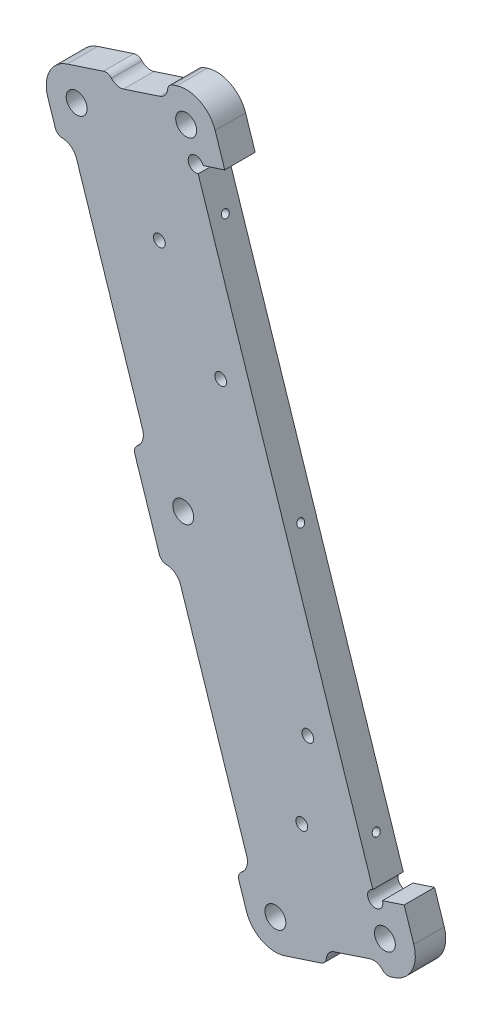
from build123d import *

# Parameters (mm, degrees)
BOSS_EXTRUDE1_DEPTH                               = 12.7
FILLET1_R                                         = 12.7
F_1_4_0_25_DIAMETER_HOLE1_D                       = 6.35
HOLE1_D                                           = 3.175
HOLE1_DEPTH                                       = 38.1
HOLE1_CSINK_D                                     = 10.16
HOLE1_CSINK_ANGLE                                 = 82
HOLE1_TIP                                         = 0.9538662327062519
F_5_16_CLEARANCE_HOLE1_D                          = 8.72998
CUT_EXTRUDE1_DEPTH                                = 998.2767957894854
FILLET2_R                                         = 3.175
CSK_FOR_8_FLAT_HEAD_MACHINE_SCREW_100_D           = 4.9149
CSK_FOR_8_FLAT_HEAD_MACHINE_SCREW_100_DEPTH       = 22.225
CSK_FOR_8_FLAT_HEAD_MACHINE_SCREW_100_CSINK_D     = 16.0004506
CSK_FOR_8_FLAT_HEAD_MACHINE_SCREW_100_CSINK_ANGLE = 100
CSK_FOR_8_FLAT_HEAD_MACHINE_SCREW_100_TIP         = 1.476584928229278


with BuildPart() as part:
    # Sketch1 → Boss-Extrude1 (new body)
    with BuildSketch(Plane.XY):
        Polygon((-504.586893891522, 825.1654748045078), (-413.82187552728277, 548.4721148571872), (-471.5394528912339, 529.5387477161187), (-562.3044712554732, 806.2321076634394), align=None)
        Polygon((-421.80123191535296, 572.7968488683923), (-413.82187552728277, 548.4721148571872), (-401.754552912923, 552.4306151945574), (-409.7339093009929, 576.7553492057625), align=None)
        Polygon((-504.586893891522, 825.1654748045078), (-492.51957127716224, 829.123975141878), (-484.5402148890918, 804.7992411306724), (-496.6075375034517, 800.8407407933022), align=None)
    extrude(amount=BOSS_EXTRUDE1_DEPTH)

    # Fillet1
    fillet1_edges = [part.edges().sort_by_distance(p)[0] for p in [
        (-401.754552912923, 552.4306151945574, 6.35),
        (-471.5394528912339, 529.5387477161187, 6.35),
        (-562.3044712554732, 806.2321076634394, 6.35),
        (-492.51957127716224, 829.123975141878, 6.35),
    ]]
    fillet(fillet1_edges, radius=FILLET1_R)

    # 1/4 (0.25) Diameter Hole1 (through all)
    with Locations(Plane(origin=(0, 0, 0), x_dir=(-1, 0, 0), z_dir=(0, 0, -1))):
        with Locations((496.607537503, 800.840740793), (421.801231915, 572.796848868)):
            Hole(F_1_4_0_25_DIAMETER_HOLE1_D / 2)

    # Hole1
    with Locations(Plane(origin=(-72.82198225638447, -450.30656055117834, -91.0749999969487), x_dir=(-4.8e-16, -1.6e-16, -1), z_dir=(0.9501828830204595, 0.3116929399504066, 0))):
        with Locations((-97.424999997, 1099.959715498), (-97.424999997, 1301.859715498), (-97.424999997, 1200.909715498)):
            CounterSinkHole(HOLE1_D / 2, HOLE1_CSINK_D / 2, depth=HOLE1_DEPTH, counter_sink_angle=HOLE1_CSINK_ANGLE)
            with Locations((0, 0, -(HOLE1_DEPTH + HOLE1_TIP / 2))):  # 118° drill point
                Cone(0, HOLE1_D / 2, HOLE1_TIP, mode=Mode.SUBTRACT)

    # 5/16 Clearance Hole1 (through all)
    with Locations(Plane.XY.offset(12.7)):
        with Locations((-546.278648304, 798.123285386), (-500.628393554, 813.09815219), (-463.430630614, 545.564570668), (-417.780375865, 560.539437472), (-501.837808805, 672.833553111)):
            Hole(F_5_16_CLEARANCE_HOLE1_D / 2)

    # Sketch9 → Cut-Extrude1 (cut, through all)
    with BuildSketch(Plane.XY.offset(12.7)):
        with BuildLine():
            Line((-529.6953014924577, 821.9412393048426), (-514.6111482245083, 826.8893647265553))
            ThreePointArc((-514.6111482245083, 826.8893647265553), (-508.60146461760905, 823.8485563726845), (-511.6422729714802, 817.838872765785))
            Line((-511.6422729714802, 817.838872765785), (-526.72642623943, 812.8907473440726))
            ThreePointArc((-526.72642623943, 812.8907473440726), (-532.7361098463288, 815.9315556979438), (-529.6953014924577, 821.9412393048426))
        make_face()
        with BuildLine():
            Line((-546.3745591048678, 778.043051296225), (-518.8053014409139, 693.9993230871839))
            ThreePointArc((-518.8053014409139, 693.9993230871839), (-522.8597125794092, 685.9864116113188), (-530.8726240552741, 690.0408227498137))
            Line((-530.8726240552741, 690.0408227498137), (-558.4418817192275, 774.084550958855))
            ThreePointArc((-558.4418817192275, 774.084550958855), (-554.3874705807326, 782.0974624347199), (-546.3745591048678, 778.043051296225))
        make_face()
        with BuildLine():
            Line((-435.961407875191, 536.1973873967519), (-420.87725460724124, 541.1455128184643))
            ThreePointArc((-420.87725460724124, 541.1455128184643), (-417.83644625337, 547.1551964253636), (-423.8461298602691, 550.1960047792348))
            Line((-423.8461298602691, 550.1960047792348), (-438.93028312821866, 545.2478793575218))
            ThreePointArc((-438.93028312821866, 545.2478793575218), (-441.9710914820897, 539.2381957506229), (-435.961407875191, 536.1973873967519))
        make_face()
        with BuildLine():
            Line((-475.40204242747944, 561.6863044207033), (-502.9713000914331, 645.7300326297446))
            ThreePointArc((-502.9713000914331, 645.7300326297446), (-510.9842115672985, 649.7844437682393), (-515.038622705793, 641.7715322923741))
            Line((-515.038622705793, 641.7715322923741), (-487.4693650418391, 557.7278040833331))
            ThreePointArc((-487.4693650418391, 557.7278040833331), (-479.4564535659742, 553.6733929448383), (-475.40204242747944, 561.6863044207033))
        make_face()
    extrude(amount=-CUT_EXTRUDE1_DEPTH, mode=Mode.SUBTRACT)

    # Fillet2
    fillet2_edges = [part.edges().sort_by_distance(p)[0] for p in [
        (-417.83644625337, 547.1551964253636, 6.35),
        (-441.97109148208983, 539.2381957506232, 6.35),
        (-522.859712579409, 685.9864116113188, 6.35),
        (-554.3874705807328, 782.0974624347198, 6.35),
        (-510.9842115672983, 649.7844437682394, 6.35),
        (-479.45645356597436, 553.6733929448382, 6.35),
        (-508.60146461760894, 823.8485563726842, 6.35),
        (-532.7361098463288, 815.9315556979437, 6.35),
    ]]
    fillet(fillet2_edges, radius=FILLET2_R)

    # CSK for #8 Flat Head Machine Screw (100)2
    with Locations(Plane(origin=(322.2568407232823, -320.70700445811474, 0), x_dir=(-0.9977564584489056, 0.06694811142592035, 0), z_dir=(0, 0, -1))):
        with Locations((876.906978493, 992.672305446), (833.265235439, 884.655200952), (904.92137181, 1028.108129087), (833.558815764, 851.479604792)):
            CounterSinkHole(CSK_FOR_8_FLAT_HEAD_MACHINE_SCREW_100_D / 2, CSK_FOR_8_FLAT_HEAD_MACHINE_SCREW_100_CSINK_D / 2, depth=CSK_FOR_8_FLAT_HEAD_MACHINE_SCREW_100_DEPTH, counter_sink_angle=CSK_FOR_8_FLAT_HEAD_MACHINE_SCREW_100_CSINK_ANGLE)
            with Locations((0, 0, -(CSK_FOR_8_FLAT_HEAD_MACHINE_SCREW_100_DEPTH + CSK_FOR_8_FLAT_HEAD_MACHINE_SCREW_100_TIP / 2))):  # 118° drill point
                Cone(0, CSK_FOR_8_FLAT_HEAD_MACHINE_SCREW_100_D / 2, CSK_FOR_8_FLAT_HEAD_MACHINE_SCREW_100_TIP, mode=Mode.SUBTRACT)


solid = part.part
